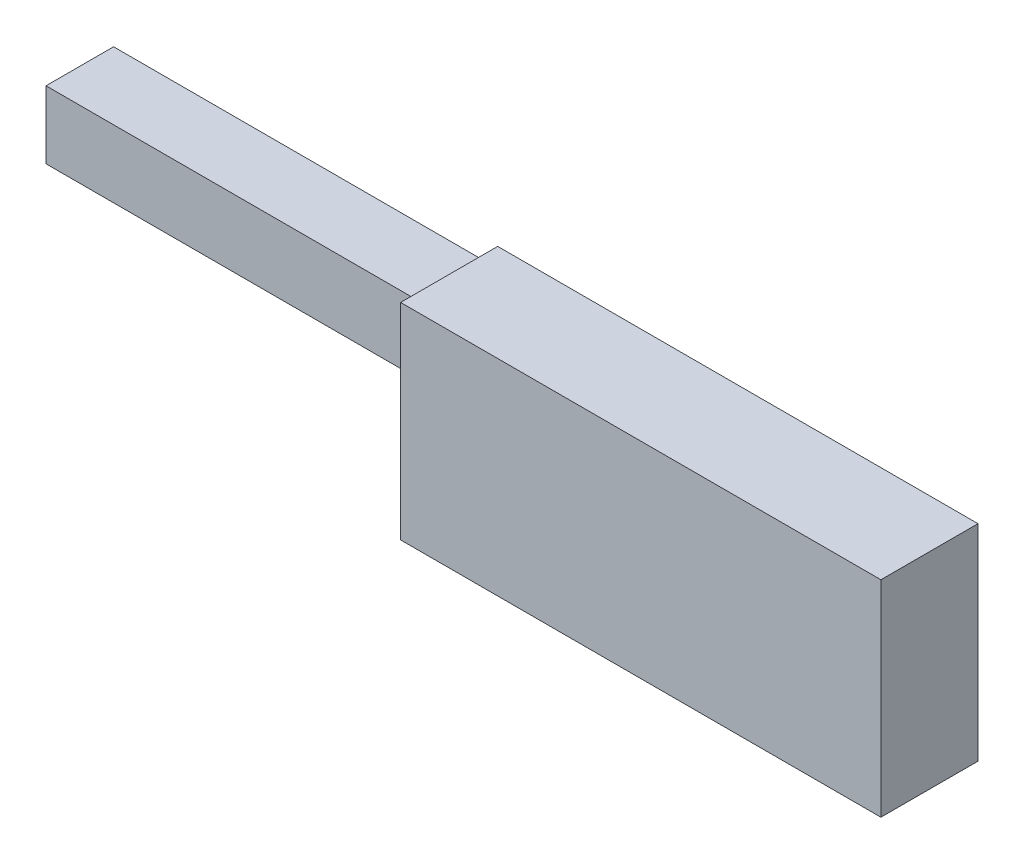
from build123d import *

# Parameters (mm, degrees)
ESQUISSE1_W        = 42.64
ESQUISSE1_H        = 18.26
BOSS_EXTRU_1_DEPTH = 8.62
ESQUISSE2_W        = 6
ESQUISSE2_H        = 6
BOSS_EXTRU_2_DEPTH = 33


with BuildPart() as part:
    # Esquisse1 → Boss.-Extru.1 (new body)
    with BuildSketch(Plane.XY):
        with Locations((21.32, 9.13)):
            Rectangle(ESQUISSE1_W, ESQUISSE1_H)
    extrude(amount=BOSS_EXTRU_1_DEPTH)

    # Esquisse2 → Boss.-Extru.2 (add)
    with BuildSketch(Plane.ZY):
        with Locations((4.099758802, 14.657271299)):
            Rectangle(ESQUISSE2_W, ESQUISSE2_H)
    extrude(amount=BOSS_EXTRU_2_DEPTH)


solid = part.part
